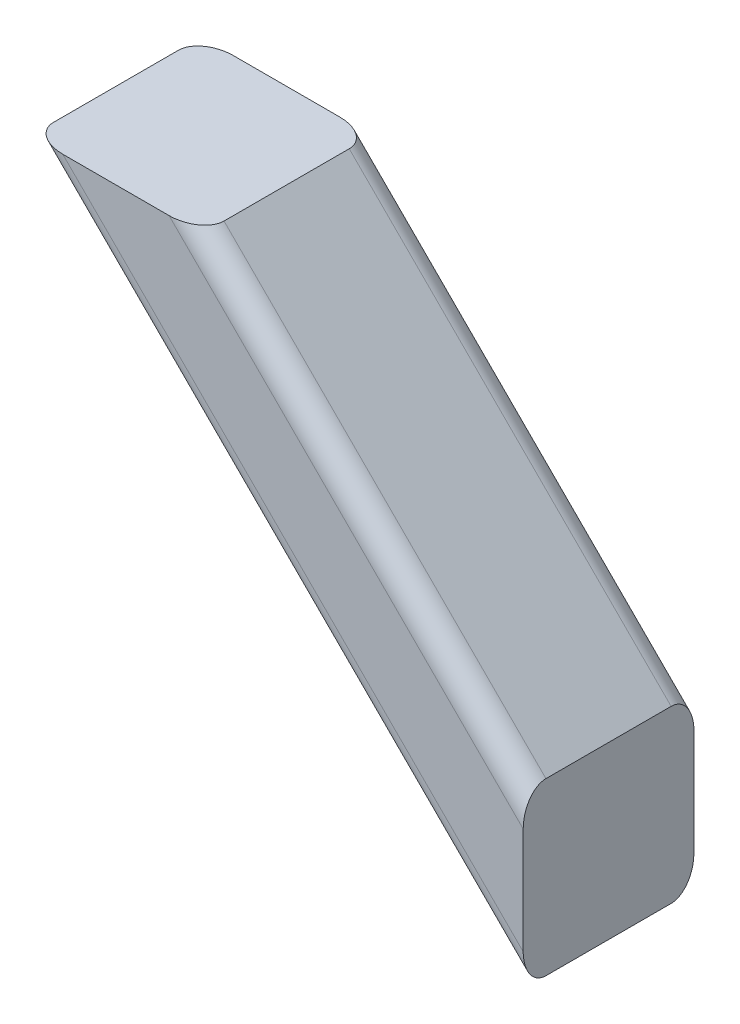
from build123d import *

# Parameters (mm, degrees)
BOSS_EXTRUDE1_DEPTH = 15
FILLET1_R           = 2


with BuildPart() as part:
    # Sketch1 → Boss-Extrude1 (new body)
    with BuildSketch(Plane.XY):
        Polygon((0, 0), (0, 15), (-28.284271247, 43.284271247), (-43.284271247, 43.284271247), align=None)
    extrude(amount=BOSS_EXTRUDE1_DEPTH)

    # Fillet1
    fillet1_edges = [part.edges().sort_by_distance(p)[0] for p in [
        (-14.142135624, 29.142135624, 15),
        (-21.642135624, 21.642135624, 15),
        (-14.142135624, 29.142135624, 0),
        (-21.642135624, 21.642135624, 0),
    ]]
    fillet(fillet1_edges, radius=FILLET1_R)


solid = part.part
